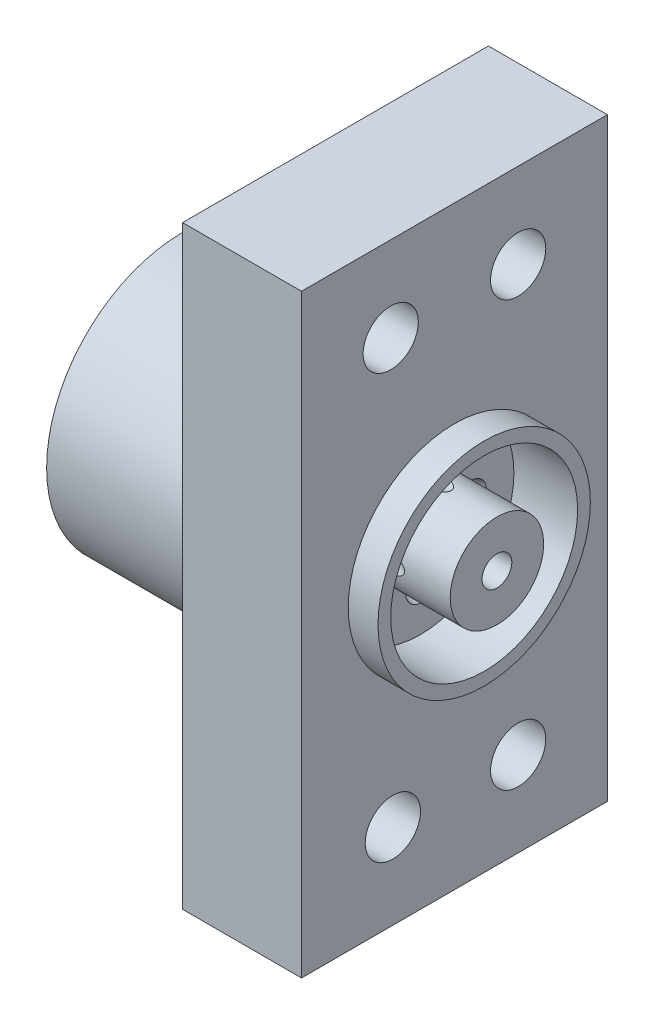
from build123d import *

# Parameters (mm, degrees)
ESQUISSE1_W                                     = 36
ESQUISSE1_H                                     = 70
BASE_EXTRUSION_DEPTH                            = 14
ESQUISSE10_R                                    = 16
BOSS_EXTRU_3_DEPTH                              = 18
ESQUISSE3_R                                     = 12.5
BOSS_EXTRU_2_DEPTH                              = 5
CHANFREIN1_SIZE                                 = 0.5
CHAMBRAGE_POUR_VIS_T_TE_CYLINDRIQUE_D           = 6.5
CHAMBRAGE_POUR_VIS_T_TE_CYLINDRIQUE_CBORE_D     = 12
CHAMBRAGE_POUR_VIS_T_TE_CYLINDRIQUE_CBORE_DEPTH = 7
R_P_TITION_CIRCULAIRE1_COUNT                    = 4


with BuildPart() as part:
    # Esquisse1 → Base-Extrusion (new body)
    with BuildSketch(Plane(origin=(0, 0, 0), x_dir=(0, 0, -1), z_dir=(1, 0, 0))):
        Rectangle(ESQUISSE1_W, ESQUISSE1_H)
    extrude(amount=-BASE_EXTRUSION_DEPTH)

    # Esquisse10 → Boss.-Extru.3 (add)
    with BuildSketch(Plane.ZY.offset(14)):
        Circle(ESQUISSE10_R)
    extrude(amount=BOSS_EXTRU_3_DEPTH)

    # Esquisse3 → Boss.-Extru.2 (add)
    with BuildSketch(Plane(origin=(0, 0, 0), x_dir=(0, 0, -1), z_dir=(1, 0, 0))):
        Circle(ESQUISSE3_R)
    extrude(amount=BOSS_EXTRU_2_DEPTH)

    # Chanfrein1
    chanfrein1_edges = [part.edges().sort_by_distance(p)[0] for p in [
        (5, 0, 12.5),
    ]]
    chamfer(chanfrein1_edges, length=CHANFREIN1_SIZE)

    # Chambrage pour vis à tête cylindrique à 6 pans creux (vis CHC) M51 (through all)
    with Locations(Plane.ZY.offset(14)):
        with Locations((-7.5, 25), (7.5, 25), (7.252144403, -25), (-7.5, -25)):
            CounterBoreHole(CHAMBRAGE_POUR_VIS_T_TE_CYLINDRIQUE_D / 2, CHAMBRAGE_POUR_VIS_T_TE_CYLINDRIQUE_CBORE_D / 2, CHAMBRAGE_POUR_VIS_T_TE_CYLINDRIQUE_CBORE_DEPTH)

    # Esquisse6 → Enlèvement de matière-Révolution1 (revolve, cut)
    with BuildSketch(Plane.XY):
        Polygon((-32, 1.75), (5, 1.75), (5, 5.5), (-4, 5.5), (-4, 11), (3.5, 11), (3.5, 13.852176113), (8, 13.852176113), (8, 0), (-32, 0), align=None)
    revolve(axis=Axis((0, 0, 0), (1, 0, 0)), mode=Mode.SUBTRACT)

    # Esquisse8 → Perçage1 (revolve, cut)
    with BuildSketch(Plane(origin=(-32, 0, 0), x_dir=(0, 0, 1), z_dir=(0, 1, 0))):
        Polygon((0, 0), (0, 26.296153426), (7.15, 22), (7.15, 20), (7.278667579, 20), (7.903, 0), align=None)
    revolve(axis=Axis((-38.35, 0, 0), (1, 0, 0)), mode=Mode.SUBTRACT)

    # Esquisse9 → Enlèvement de matière-Révolution2 (revolve, cut)
    with BuildSketch(Plane.XY):
        Polygon((-11.907222504, 4.382957476), (0.437240206, 9.643680185), (1.123318493, 8.033774416), (-11.221144216, 2.773051707), align=None)
    enl_vement_de_mati_re_r_volution2 = revolve(axis=Axis((-35.796822369, -7.700132197, 0), (0.9199461534250014, 0.39204473571079074, 0)), mode=Mode.SUBTRACT)

    # Répétition circulaire1: Enlèvement de matière-Révolution2 ×4 about axis
    r_p_tition_circulaire1_axis = Axis((50, 0, 0), (-1, 0, 0))
    for i in range(1, R_P_TITION_CIRCULAIRE1_COUNT):
        add(enl_vement_de_mati_re_r_volution2.rotate(r_p_tition_circulaire1_axis, i * 360 / R_P_TITION_CIRCULAIRE1_COUNT), mode=Mode.SUBTRACT)


solid = part.part
